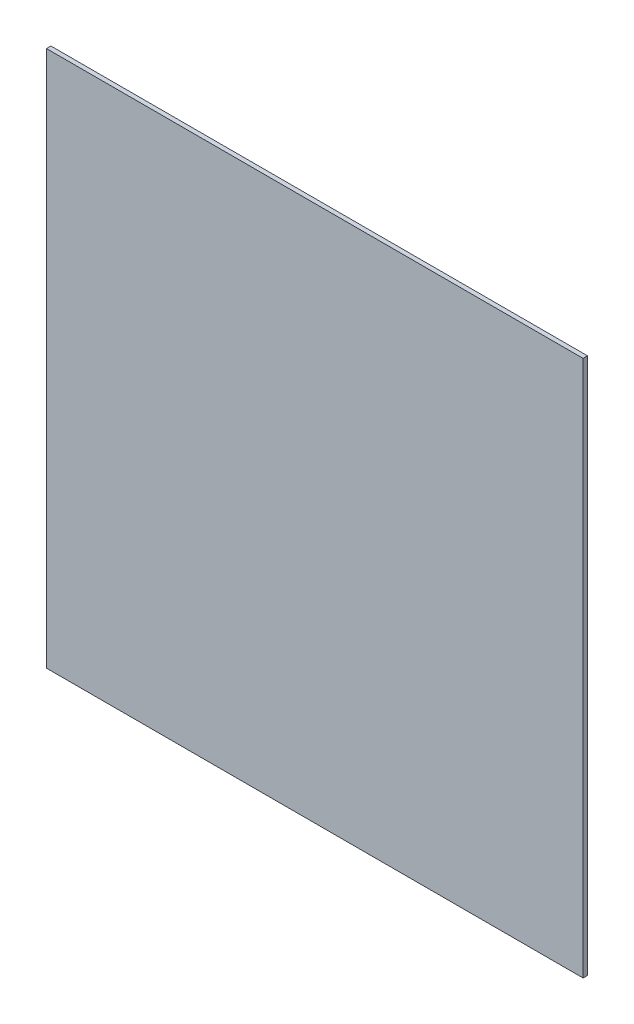
from build123d import *

# Parameters (mm, degrees)
SKETCH1_W           = 121
SKETCH1_H           = 121
BOSS_EXTRUDE1_DEPTH = 1


with BuildPart() as part:
    # Sketch1 → Boss-Extrude1 (new body)
    with BuildSketch(Plane.XY):
        Rectangle(SKETCH1_W, SKETCH1_H)
    extrude(amount=BOSS_EXTRUDE1_DEPTH)


solid = part.part
